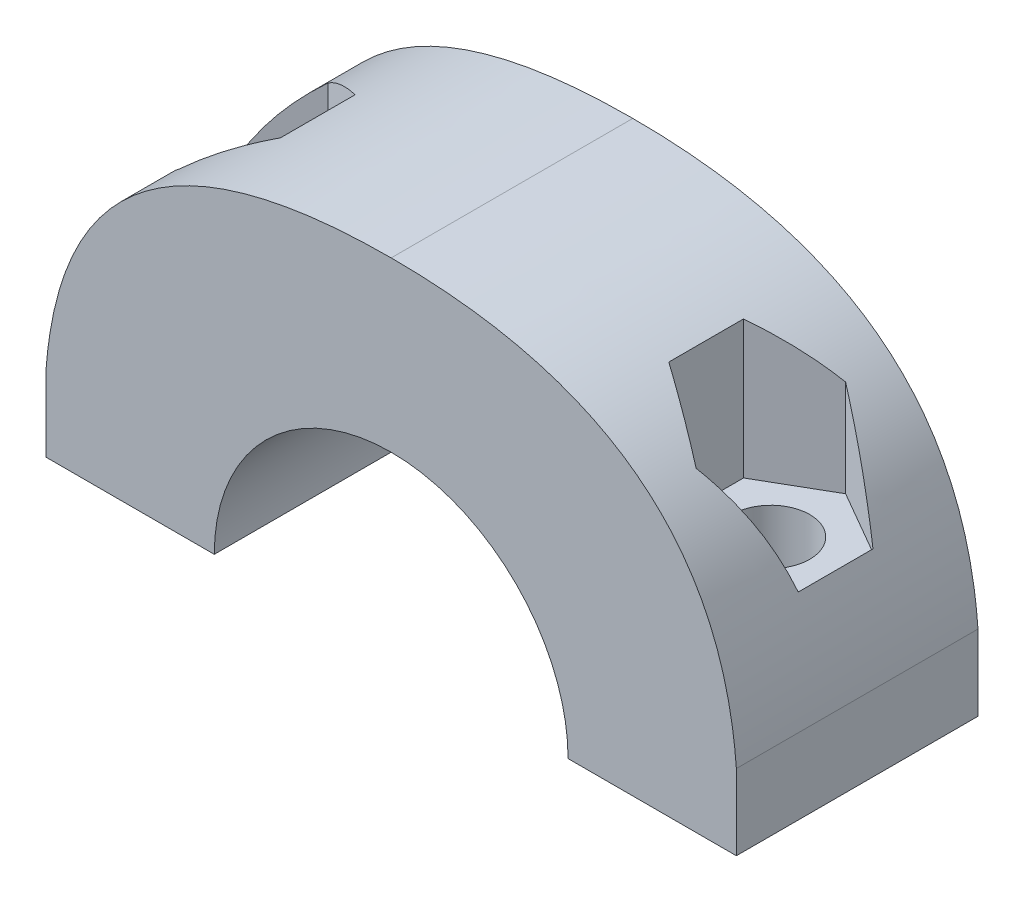
from build123d import *

# Parameters (mm, degrees)
BOSS_EXTRUDE1_DEPTH    = 7
FILLET1_R              = 2
SPLIT1_SURFACE_1_BACK  = 47.861
SPLIT1_SURFACE_1_DEPTH = 95.722
SPLIT1_SURFACE_2_BACK  = 47.861
SPLIT1_SURFACE_2_DEPTH = 95.722
CUT_EXTRUDE2_DEPTH     = 14
CUT_EXTRUDE8_DEPTH     = 32.559467847
SKETCH10_R             = 2.25
CUT_EXTRUDE6_DEPTH     = 35
CUT_EXTRUDE7_DEPTH     = 10
BOSS_EXTRUDE2_DEPTH    = 14


with BuildPart() as part:
    # Sketch1 → Boss-Extrude1 (new, symmetric)
    with BuildSketch(Plane.XY):
        with BuildLine():
            Line((10.25, 0), (20, 0))
            Line((20, 0), (20, 20))
            Line((20, 20), (-20, 20))
            Line((-20, 20), (-20, 0))
            Line((-20, 0), (-10.25, 0))
            ThreePointArc((-10.25, 0), (0, 10.25), (10.25, 0))
        make_face()
    extrude(amount=BOSS_EXTRUDE1_DEPTH, both=True)

    # Fillet1
    fillet1_edges = [part.edges().sort_by_distance(p)[0] for p in [
        (20, 0, 0),
        (-20, 0, 0),
    ]]
    fillet(fillet1_edges, radius=FILLET1_R)


with BuildPart() as body_2:
    # Split1: the piece behind the surface
    add(part.part)
    # Split1 surface: a surface, the sketch's curves swept straight by 95.722 mm
    with BuildLine(Plane.XY.offset(7).offset(-SPLIT1_SURFACE_1_BACK), mode=Mode.PRIVATE) as split1_surface_1_path:
        Line((0, 20), (0, 0))
    split1_surface_1 = Shell.extrude(split1_surface_1_path.wire(), (0 * SPLIT1_SURFACE_1_DEPTH, 0 * SPLIT1_SURFACE_1_DEPTH, 1 * SPLIT1_SURFACE_1_DEPTH))
    split(bisect_by=split1_surface_1, keep=Keep.BOTTOM)

    # Sketch6 → Cut-Extrude2 (cut)
    with BuildSketch(Plane.XY.offset(7)):
        with BuildLine():
            Line((-20, 20), (-20, 4.378237371))
            add(Edge.make_bspline(
                [(0, 20), (-18.821096643, 20), (-20, 4.378237371)],
                knots=[0, 0, 0, 0.882109664, 0.882109664, 0.882109664], degree=2))
            Line((0, 20), (-20, 20))
        make_face()
    extrude(amount=-CUT_EXTRUDE2_DEPTH, mode=Mode.SUBTRACT)


with BuildPart() as part_1:
    add(part.part)

    # Split1: split by a surface, the side it looks to stays
    # Split1 surface: a surface, the sketch's curves swept straight by 95.722 mm
    with BuildLine(Plane.XY.offset(7).offset(-SPLIT1_SURFACE_2_BACK), mode=Mode.PRIVATE) as split1_surface_2_path:
        Line((0, 20), (0, 0))
    split1_surface_2 = Shell.extrude(split1_surface_2_path.wire(), (0 * SPLIT1_SURFACE_2_DEPTH, 0 * SPLIT1_SURFACE_2_DEPTH, 1 * SPLIT1_SURFACE_2_DEPTH))
    split(bisect_by=split1_surface_2, keep=Keep.TOP)

    # Sketch6<3> → Cut-Extrude8 (cut, through all)
    with BuildSketch(Plane.XY.offset(7)):
        with BuildLine():
            Line((20, 20), (0, 20))
            add(Edge.make_bspline(
                [(0, 20), (18.821096643, 20), (20, 4.378237371)],
                knots=[0, 0, 0, 0.882109664, 0.882109664, 0.882109664], degree=2))
            Line((20, 4.378237371), (20, 20))
        make_face()
    extrude(amount=-CUT_EXTRUDE8_DEPTH, mode=Mode.SUBTRACT)


with BuildPart() as cut_extrude6_tool:
    # Sketch10 → Cut-Extrude6 (new body)
    with BuildSketch(Plane.XZ):
        with Locations((15, 0)):
            Circle(SKETCH10_R)
        with Locations((-15, 0)):
            Circle(SKETCH10_R)
    extrude(amount=-CUT_EXTRUDE6_DEPTH)


with BuildPart() as part_2:
    add(part_1.part)

    # Cut-Extrude6: cut by cut_extrude6_tool
    add(cut_extrude6_tool.part, mode=Mode.SUBTRACT)


with BuildPart() as body_2_1:
    add(body_2.part)

    # Cut-Extrude6: cut by cut_extrude6_tool
    add(cut_extrude6_tool.part, mode=Mode.SUBTRACT)


with BuildPart() as cut_extrude7_tool:
    # Sketch11 → Cut-Extrude7 (new body)
    with BuildSketch(Plane(origin=(0, 20, 0), x_dir=(1, 0, 0), z_dir=(0, 1, 0))):
        Polygon((-11.25, -2.165063509), (-11.25, 2.165063509), (-15, 4.330127019), (-18.75, 2.165063509), (-18.75, -2.165063509), (-15, -4.330127019), align=None)
        Polygon((15, -4.330127019), (11.25, -2.165063509), (11.25, 2.165063509), (15, 4.330127019), (18.75, 2.165063509), (18.75, -2.165063509), align=None)
    extrude(amount=-CUT_EXTRUDE7_DEPTH)


with BuildPart() as part_3:
    add(part_2.part)

    # Cut-Extrude7: cut by cut_extrude7_tool
    add(cut_extrude7_tool.part, mode=Mode.SUBTRACT)


with BuildPart() as body_2_2:
    add(body_2_1.part)

    # Cut-Extrude7: cut by cut_extrude7_tool
    add(cut_extrude7_tool.part, mode=Mode.SUBTRACT)

    # Combine1: union part
    add(part_3.part)

    # Sketch12 → Boss-Extrude2 (add)
    with BuildSketch(Plane.XY.offset(7)):
        with BuildLine():
            Line((-18, 0), (-20, 0))
            Line((-20, 0), (-20, 2))
            ThreePointArc((-20, 2), (-19.414213562, 0.585786438), (-18, 0))
        make_face()
        with BuildLine():
            Line((18, 0), (20, 0))
            Line((20, 0), (20, 2))
            ThreePointArc((20, 2), (19.414213562, 0.585786438), (18, 0))
        make_face()
    extrude(amount=-BOSS_EXTRUDE2_DEPTH)


solid = body_2_2.part
